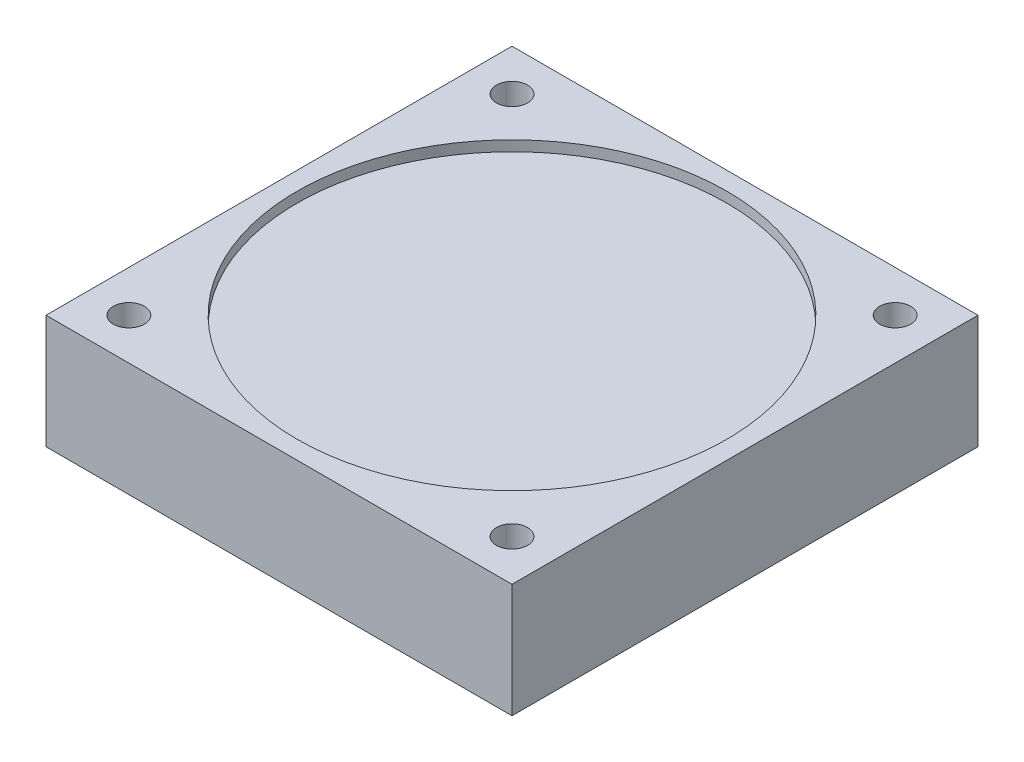
from build123d import *

# Parameters (mm, degrees)
SKETCH1_W           = 45
SKETCH1_H           = 45
SKETCH1_R           = 1.5
BOSS_EXTRUDE1_DEPTH = 11
SKETCH2_R           = 20.75
CUT_EXTRUDE1_DEPTH  = 1


with BuildPart() as part:
    # Sketch1 → Boss-Extrude1 (new body)
    with BuildSketch(Plane(origin=(0, 0, 0), x_dir=(1, 0, 0), z_dir=(0, 1, 0))):
        with Locations((-3.662790698, 9.811046512)):
            Rectangle(SKETCH1_W, SKETCH1_H)
        with Locations(Location((-22.162790698, 28.311046512, 0), (0, 0, 270))):
            Circle(SKETCH1_R, mode=Mode.SUBTRACT)
        with Locations(Location((14.837209302, 28.311046512, 0), (0, 0, 270))):
            Circle(SKETCH1_R, mode=Mode.SUBTRACT)
        with Locations(Location((-22.162790698, -8.688953488, 0), (0, 0, 270))):
            Circle(SKETCH1_R, mode=Mode.SUBTRACT)
        with Locations(Location((14.837209302, -8.688953488, 0), (0, 0, 270))):
            Circle(SKETCH1_R, mode=Mode.SUBTRACT)
    extrude(amount=BOSS_EXTRUDE1_DEPTH)

    # Sketch2 → Cut-Extrude1 (cut)
    with BuildSketch(Plane(origin=(0, 11, 0), x_dir=(1, 0, 0), z_dir=(0, 1, 0))):
        with Locations(Location((-3.662790698, 9.811046512, 0), (0, 0, 270))):
            Circle(SKETCH2_R)
    extrude(amount=-CUT_EXTRUDE1_DEPTH, mode=Mode.SUBTRACT)


solid = part.part
